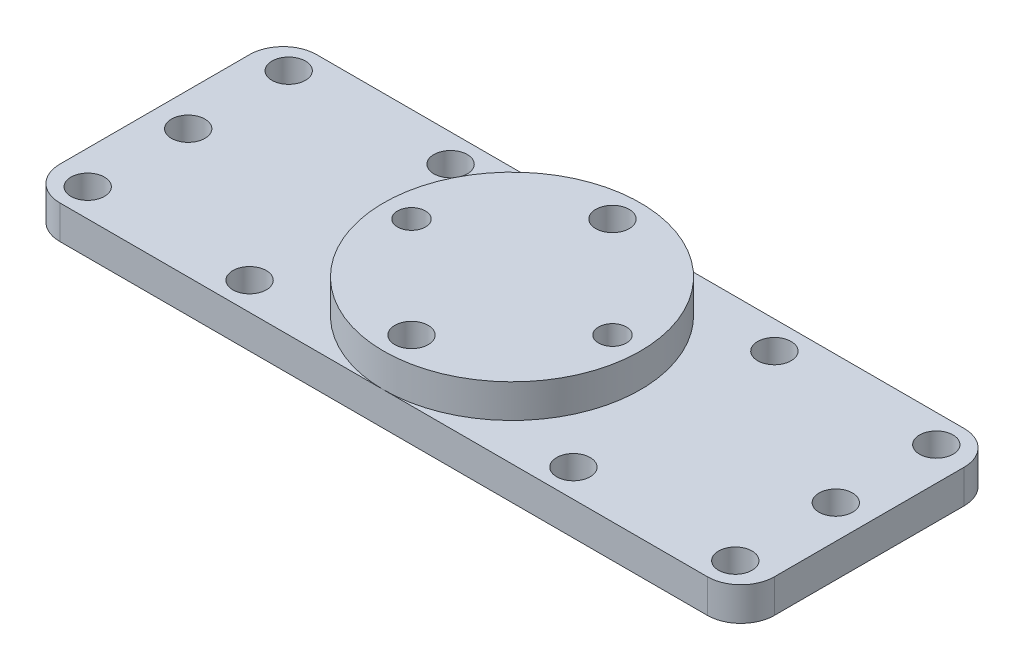
from build123d import *

# Parameters (mm, degrees)
SKETCH1_W                 = 64
SKETCH1_H                 = 23
BOSS_EXTRUDE1_DEPTH       = 3
F_3_0_3_DIAMETER_HOLE1_D  = 3
FILLET1_R                 = 3
SKETCH5_R                 = 11.5
BOSS_EXTRUDE2_DEPTH       = 3
F_3_0_3_DIAMETER_HOLE2_D  = 3
M3X0_5_TAPPED_HOLE1_D     = 2.5
M3X0_5_TAPPED_HOLE1_DEPTH = 4.748924226
M3X0_5_TAPPED_HOLE1_TIP   = 0.751075774


with BuildPart() as part:
    # Sketch1 → Boss-Extrude1 (new body)
    with BuildSketch(Plane(origin=(0, 0, 0), x_dir=(1, 0, 0), z_dir=(0, 1, 0))):
        Rectangle(SKETCH1_W, SKETCH1_H)
    extrude(amount=-BOSS_EXTRUDE1_DEPTH)

    # Ø3.0 (3) Diameter Hole1 (through all)
    with Locations(Plane(origin=(0, 0, 0), x_dir=(1, 0, 0), z_dir=(0, 1, 0))):
        with Locations((-29, 0), (-29, 9), (-14.5, 9), (-14.5, -9), (-29, -9)):
            f_3_0_3_diameter_hole1 = Hole(F_3_0_3_DIAMETER_HOLE1_D / 2)

    # Mirror1: Ø3.0 (3) Diameter Hole1 across plane
    add(f_3_0_3_diameter_hole1.mirror(Plane(origin=(0, 0, 0), x_dir=(0, 0, 1), z_dir=(1, 0, 0))), mode=Mode.SUBTRACT)

    # Fillet1
    fillet1_edges = [part.edges().sort_by_distance(p)[0] for p in [
        (32, -1.5, 11.5),
        (-32, -1.5, 11.5),
        (-32, -1.5, -11.5),
        (32, -1.5, -11.5),
    ]]
    fillet(fillet1_edges, radius=FILLET1_R)

    # Sketch5 → Boss-Extrude2 (add)
    with BuildSketch(Plane(origin=(0, 0, 0), x_dir=(1, 0, 0), z_dir=(0, 1, 0))):
        with Locations(Location((0, 0, 0), (0, 0, 270))):
            Circle(SKETCH5_R)
    extrude(amount=BOSS_EXTRUDE2_DEPTH)

    # Ø3.0 (3) Diameter Hole2 (through all)
    with Locations(Plane(origin=(0, 3, 0), x_dir=(1, 0, 0), z_dir=(0, 1, 0))):
        with Locations((0, 9), (0, -9)):
            Hole(F_3_0_3_DIAMETER_HOLE2_D / 2)

    # M3x0.5 Tapped Hole1
    with Locations(Plane(origin=(0, 3, 0), x_dir=(1, 0, 0), z_dir=(0, 1, 0))):
        with Locations((-9, 0), (9, 0)):
            Hole(M3X0_5_TAPPED_HOLE1_D / 2, depth=M3X0_5_TAPPED_HOLE1_DEPTH)
            with Locations((0, 0, -(M3X0_5_TAPPED_HOLE1_DEPTH + M3X0_5_TAPPED_HOLE1_TIP / 2))):  # 118° drill point
                Cone(0, M3X0_5_TAPPED_HOLE1_D / 2, M3X0_5_TAPPED_HOLE1_TIP, mode=Mode.SUBTRACT)


solid = part.part
